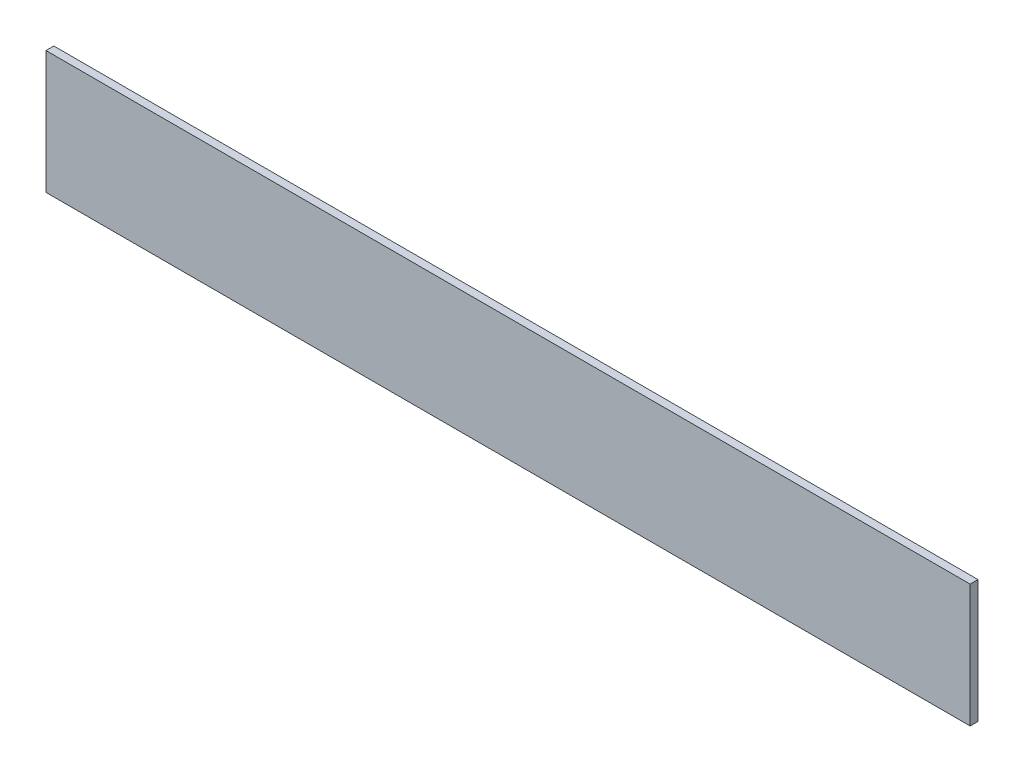
from build123d import *

# Parameters (mm, degrees)
SKETCH1_W           = 382.06523237
SKETCH1_H           = 3.24696721
BOSS_EXTRUDE1_DEPTH = 50.8


with BuildPart() as part:
    # Sketch1 → Boss-Extrude1 (new body)
    with BuildSketch(Plane(origin=(0, 0, 0), x_dir=(1, 0, 0), z_dir=(0, 1, 0))):
        Rectangle(SKETCH1_W, SKETCH1_H)
    extrude(amount=BOSS_EXTRUDE1_DEPTH)


solid = part.part
